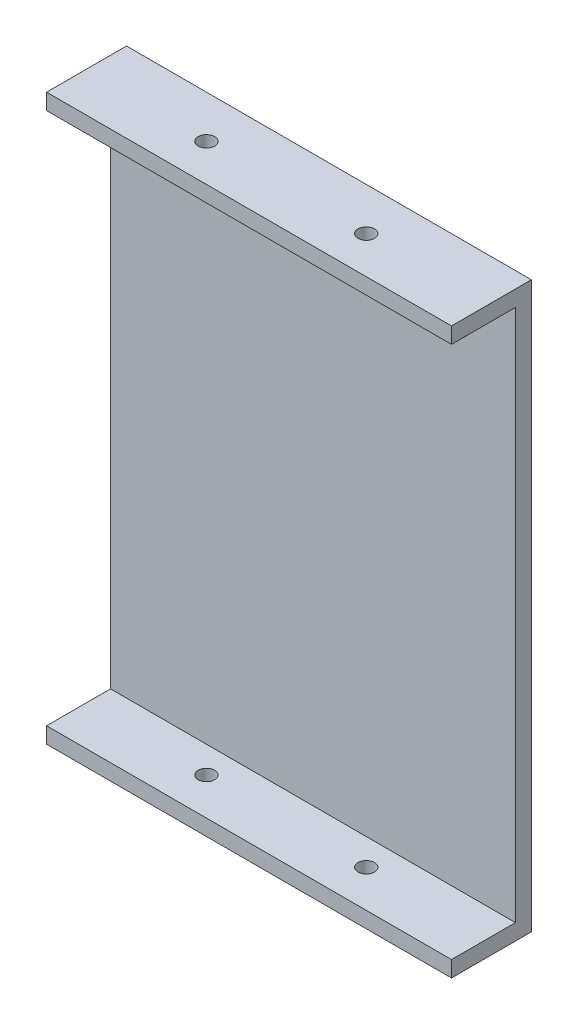
from build123d import *

# Parameters (mm, degrees)
SKETCH_1_W          = 76
SKETCH_1_H          = 190
SKETCH_1_R          = 1.55
EXTRUDE_1_DEPTH     = 3
SKETCH_2_W          = 76
SKETCH_2_H          = 3
EXTRUDE_2_DEPTH     = 12
SKETCH_3_R          = 1.55
CUT_EXTRUDE_1_DEPTH = 168.047897323
SKETCH_4_W          = 76
SKETCH_4_H          = 42
CUT_EXTRUDE_2_DEPTH = 10


with BuildPart() as part:
    # 草图1 → 凸台-拉伸1 (new body)
    with BuildSketch(Plane.XY):
        with Locations((38, 95)):
            Rectangle(SKETCH_1_W, SKETCH_1_H)
        with Locations((63, 10)):
            Circle(SKETCH_1_R, mode=Mode.SUBTRACT)
        with Locations((13, 10)):
            Circle(SKETCH_1_R, mode=Mode.SUBTRACT)
        with Locations((63, 180)):
            Circle(SKETCH_1_R, mode=Mode.SUBTRACT)
        with Locations((13, 180)):
            Circle(SKETCH_1_R, mode=Mode.SUBTRACT)
    extrude(amount=EXTRUDE_1_DEPTH)

    # 草图2 → 凸台-拉伸2 (add)
    with BuildSketch(Plane.XY.offset(3)):
        with Locations((38, 43.5)):
            Rectangle(SKETCH_2_W, SKETCH_2_H)
        with Locations((38, 146.5)):
            Rectangle(SKETCH_2_W, SKETCH_2_H)
    extrude(amount=EXTRUDE_2_DEPTH)

    # 草图3 → 切除-拉伸1 (cut, through all)
    with BuildSketch(Plane.XZ.offset(-42)):
        with Locations(Location((23, 8, 0), (0, 0, 270))):
            Circle(SKETCH_3_R)
        with Locations(Location((53, 8, 0), (0, 0, 270))):
            Circle(SKETCH_3_R)
    extrude(amount=-CUT_EXTRUDE_1_DEPTH, mode=Mode.SUBTRACT)

    # 草图4 → 切除-拉伸2 (cut)
    with BuildSketch(Plane.XY.offset(3)):
        with Locations((38, 21)):
            Rectangle(SKETCH_4_W, SKETCH_4_H)
        with Locations((38, 169)):
            Rectangle(SKETCH_4_W, SKETCH_4_H)
    extrude(amount=-CUT_EXTRUDE_2_DEPTH, mode=Mode.SUBTRACT)


solid = part.part
